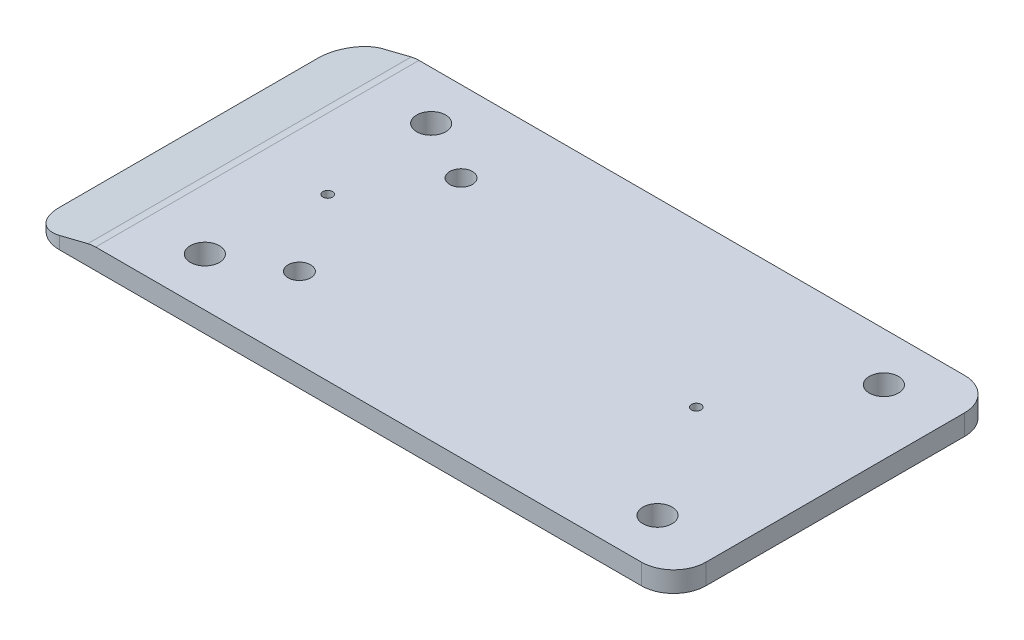
from build123d import *

# Parameters (mm, degrees)
SKETCH1_W             = 200
SKETCH1_H             = 100
BOSS_EXTRUDE1_DEPTH   = 6.35
CHAMFER1_SIZE         = 5
CHAMFER1_SIZE2        = 20
FILLET1_R             = 10
F_3_0MM_DOWEL_HOLE1_D = 3
M8_CLEARANCE_HOLE1_D  = 9
F_6_0MM_DOWEL_HOLE1_D = 7


with BuildPart() as part:
    # Sketch1 → Boss-Extrude1 (new body)
    with BuildSketch(Plane(origin=(0, 0, 0), x_dir=(1, 0, 0), z_dir=(0, 1, 0))):
        Rectangle(SKETCH1_W, SKETCH1_H)
    extrude(amount=BOSS_EXTRUDE1_DEPTH)

    # Chamfer1
    chamfer1_edges = [part.edges().sort_by_distance(p)[0] for p in [
        (-100, 6.35, 0),
    ]]
    chamfer1_side = [part.faces().sort_by_distance(p)[0] for p in [
        (-100, 3.175, 0),
    ]]
    chamfer(chamfer1_edges, length=CHAMFER1_SIZE, length2=CHAMFER1_SIZE2, reference=chamfer1_side[0])

    # Fillet1
    fillet1_edges = [part.edges().sort_by_distance(p)[0] for p in [
        (-80, 6.35, 0),
        (-100, 0.675, 50),
        (-100, 0.675, -50),
        (100, 3.175, 50),
        (100, 3.175, -50),
    ]]
    fillet(fillet1_edges, radius=FILLET1_R)

    # Ø3.0mm Dowel Hole1 (through all)
    with Locations(Plane(origin=(0, 6.35, 0), x_dir=(1, 0, 0), z_dir=(0, 1, 0))):
        with Locations((-57, 0), (57, 0)):
            Hole(F_3_0MM_DOWEL_HOLE1_D / 2)

    # M8 Clearance Hole1 (through all)
    with Locations(Plane(origin=(0, 6.35, 0), x_dir=(1, 0, 0), z_dir=(0, 1, 0))):
        with Locations((-60, 35), (80, -35), (-60, -35), (80, 35)):
            Hole(M8_CLEARANCE_HOLE1_D / 2)

    # Ø6.0mm Dowel Hole1 (through all)
    with Locations(Plane(origin=(0, 6.35, 0), x_dir=(1, 0, 0), z_dir=(0, 1, 0))):
        with Locations((-40.768943744, 25), (-40.768943744, -25)):
            Hole(F_6_0MM_DOWEL_HOLE1_D / 2)


solid = part.part
